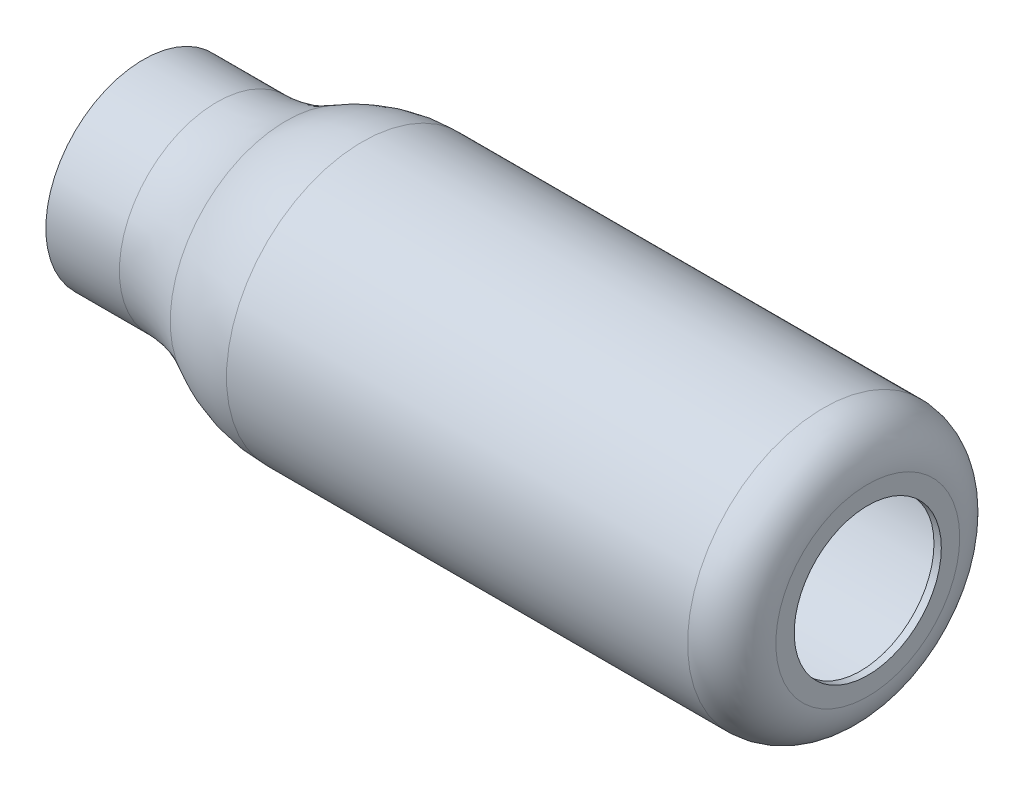
from build123d import *


with BuildPart() as part:
    # Sketch1 → Revolve-Thin1 (revolve)
    with BuildSketch(Plane.XY, mode=Mode.PRIVATE) as revolve_thin1_sk:
        with BuildLine():
            Line((0, 12.7), (0, 15.875))
            ThreePointArc((0, 15.875), (-1.859871939, 20.365128061), (-6.35, 22.225))
            Line((-6.35, 22.225), (-85.966255124, 22.225))
            ThreePointArc((-85.966255124, 22.225), (-92.47306886, 21.37742096), (-98.545627562, 18.89125))
            ThreePointArc((-98.545627562, 18.89125), (-104.618186264, 16.40507904), (-111.125, 15.5575))
            Line((-111.125, 15.5575), (-123.825, 15.5575))
            Line((-123.825, 15.5575), (-123.825, 16.8275))
            Line((-123.825, 16.8275), (-111.125, 16.8275))
            ThreePointArc((-111.125, 16.8275), (-104.94352695, 17.632700088), (-99.174596184, 19.9945625))
            ThreePointArc((-99.174596184, 19.9945625), (-92.798409547, 22.605042008), (-85.966255124, 23.495))
            Line((-85.966255124, 23.495), (-6.35, 23.495))
            ThreePointArc((-6.35, 23.495), (-0.961846327, 21.263153673), (1.27, 15.875))
            Line((1.27, 15.875), (1.27, 12.7))
            Line((1.27, 12.7), (0, 12.7))
        make_face()
    revolve(revolve_thin1_sk.sketch.rotate(Axis((0, 0, 0), (-1, 0, 0)), 90), axis=Axis((0, 0, 0), (-1, 0, 0)))


solid = part.part
